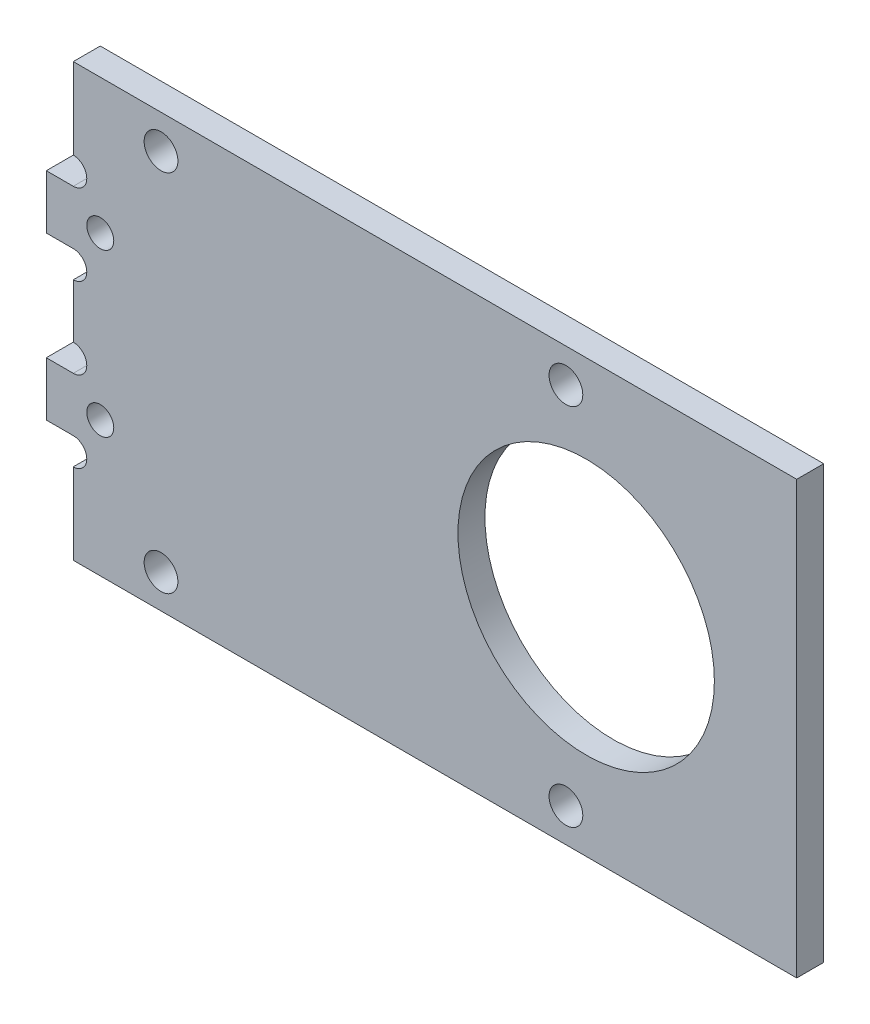
from build123d import *

# Parameters (mm, degrees)
SKETCH_1_R      = 1
SKETCH_1_R_2    = 1.25
SKETCH_1_R_3    = 9.5
EXTRUDE_1_DEPTH = 2


with BuildPart() as part:
    # 草圖1 → 填料-伸長1 (new body)
    with BuildSketch(Plane.XY):
        with BuildLine():
            Line((-8.868434636, 14.893709246), (-8.868434636, 15.893709246))
            Line((-8.868434636, 15.893709246), (-7.868434636, 15.893709246))
            Line((-7.868434636, 15.893709246), (43.781565364, 15.893709246))
            Line((43.781565364, 15.893709246), (44.731565364, 15.893709246))
            Line((44.731565364, 15.893709246), (44.731565364, 14.893709246))
            Line((44.731565364, 14.893709246), (44.731565364, -15.106290754))
            Line((44.731565364, -15.106290754), (44.731565364, -16.106290754))
            Line((44.731565364, -16.106290754), (43.781565364, -16.106290754))
            Line((43.781565364, -16.106290754), (-7.868434636, -16.106290754))
            Line((-7.868434636, -16.106290754), (-8.868434636, -16.106290754))
            Line((-8.868434636, -16.106290754), (-8.868434636, -15.106290754))
            Line((-8.868434636, -15.106290754), (-8.868434636, -10.106290754))
            ThreePointArc((-8.868434636, -10.106290754), (-7.868434636, -9.106290754), (-8.868434636, -8.106290754))
            Line((-8.868434636, -8.106290754), (-10.868434636, -8.106290754))
            Line((-10.868434636, -8.106290754), (-10.868434636, -4.106290754))
            Line((-10.868434636, -4.106290754), (-8.868434636, -4.106290754))
            ThreePointArc((-8.868434636, -4.106290754), (-7.868434636, -3.106290754), (-8.868434636, -2.106290754))
            Line((-8.868434636, -2.106290754), (-8.868434636, 1.893709246))
            ThreePointArc((-8.868434636, 1.893709246), (-7.868434636, 2.893709246), (-8.868434636, 3.893709246))
            Line((-8.868434636, 3.893709246), (-10.868434636, 3.893709246))
            Line((-10.868434636, 3.893709246), (-10.868434636, 7.893709246))
            Line((-10.868434636, 7.893709246), (-8.868434636, 7.893709246))
            ThreePointArc((-8.868434636, 7.893709246), (-7.868434636, 8.893709246), (-8.868434636, 9.893709246))
            Line((-8.868434636, 9.893709246), (-8.868434636, 14.893709246))
        make_face()
        with Locations((-6.868434636, 5.893709246)):
            Circle(SKETCH_1_R, mode=Mode.SUBTRACT)
        with Locations((-6.868434636, -6.106290754)):
            Circle(SKETCH_1_R, mode=Mode.SUBTRACT)
        with Locations((-2.368434636, 13.393709246)):
            Circle(SKETCH_1_R_2, mode=Mode.SUBTRACT)
        with Locations((-2.368434636, -13.606290754)):
            Circle(SKETCH_1_R_2, mode=Mode.SUBTRACT)
        with Locations((27.631565364, 13.393709246)):
            Circle(SKETCH_1_R_2, mode=Mode.SUBTRACT)
        with Locations((27.631565364, -13.606290754)):
            Circle(SKETCH_1_R_2, mode=Mode.SUBTRACT)
        with Locations((29.131565364, -0.106290754)):
            Circle(SKETCH_1_R_3, mode=Mode.SUBTRACT)
    extrude(amount=EXTRUDE_1_DEPTH)


solid = part.part
